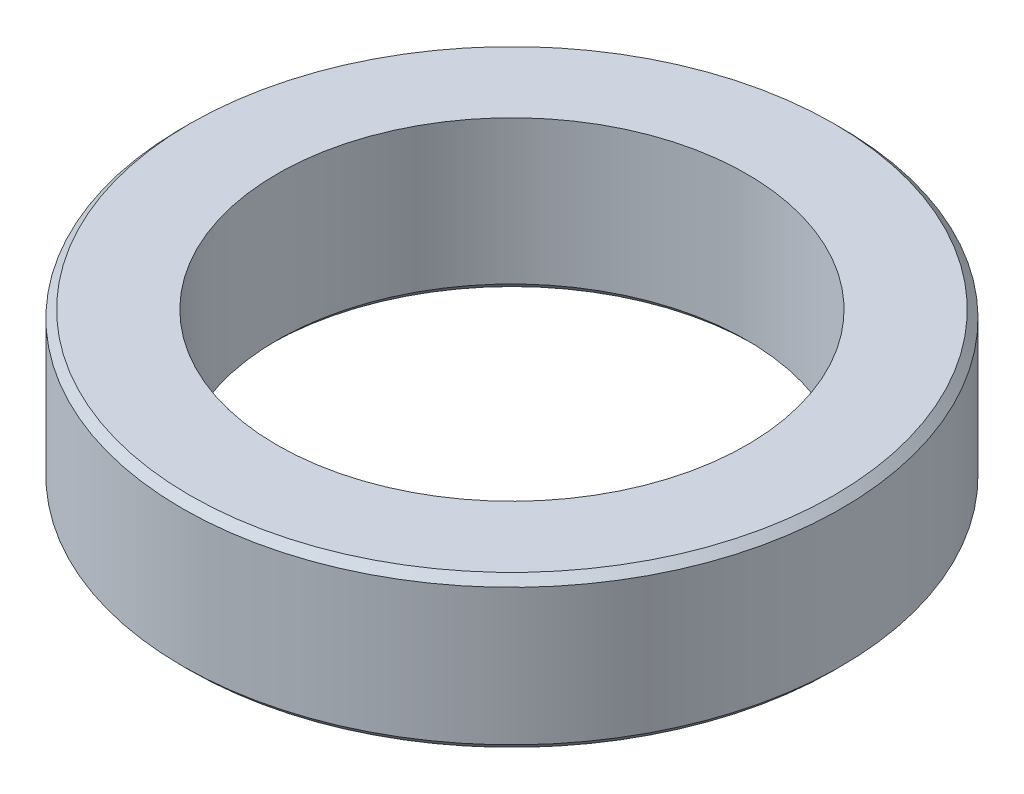
from build123d import *

# Parameters (mm, degrees)
SKETCH1_R           = 110.49
SKETCH1_R_2         = 78.74
BOSS_EXTRUDE1_DEPTH = 50.8
CHAMFER1_SIZE       = 2.54


with BuildPart() as part:
    # Sketch1 → Boss-Extrude1 (new body)
    with BuildSketch(Plane(origin=(0, 0, 0), x_dir=(1, 0, 0), z_dir=(0, 1, 0))):
        with Locations(Location((0, 0, 0), (0, 0, 270))):
            Circle(SKETCH1_R)
        with Locations(Location((0, 0, 0), (0, 0, 270))):
            Circle(SKETCH1_R_2, mode=Mode.SUBTRACT)
    extrude(amount=BOSS_EXTRUDE1_DEPTH)

    # Chamfer1
    chamfer1_edges = [part.edges().sort_by_distance(p)[0] for p in [
        (0, 0, -110.49),
        (0, 50.8, -110.49),
        (0, 0, -78.74),
    ]]
    chamfer(chamfer1_edges, length=CHAMFER1_SIZE)


solid = part.part
